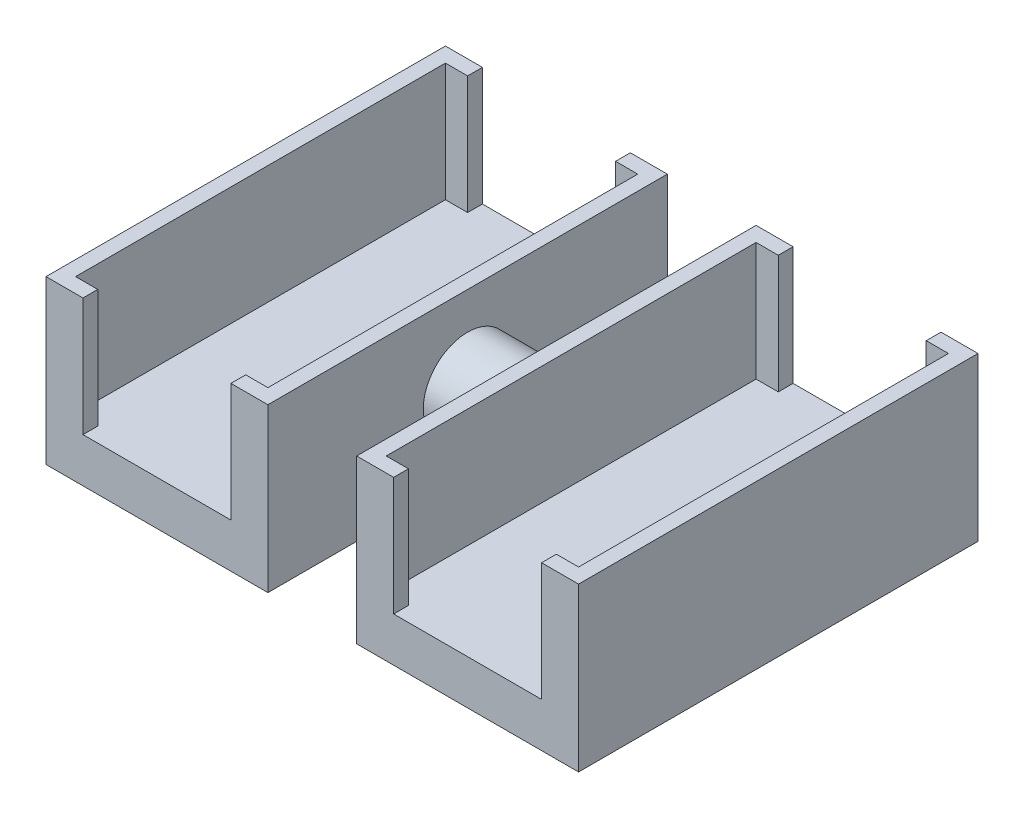
from build123d import *

# Parameters (mm, degrees)
BASE_REFERENCE_SKETCH_W = 15
BASE_REFERENCE_SKETCH_H = 27
BASE_EXTRUDE_DEPTH      = 3
BOSS_EXTRUDE2_START     = 3
BOSS_EXTRUDE2_DEPTH     = 8
BOSS_EXTRUDE4_START     = -3
SKETCH1_R               = 3
SKETCH1_R_2             = 1.5
BOSS_EXTRUDE4_DEPTH     = 6


with BuildPart() as part:
    # Base Reference Sketch → Base Extrude (new body)
    with BuildSketch(Plane(origin=(0, 0, 0), x_dir=(1, 0, 0), z_dir=(0, 1, 0))):
        with Locations((-10.5, 0)):
            Rectangle(BASE_REFERENCE_SKETCH_W, BASE_REFERENCE_SKETCH_H)
    extrude(amount=BASE_EXTRUDE_DEPTH)

    # Base Reference Sketch<5> → Boss-Extrude2 (add)
    with BuildSketch(Plane(origin=(0, 0, 0), x_dir=(1, 0, 0), z_dir=(0, 1, 0)).offset(BOSS_EXTRUDE2_START)):
        Polygon((-18, 13.5), (-15.5, 13.5), (-15.5, 12.5), (-17, 12.5), (-17, -12.5), (-15.5, -12.5), (-15.5, -13.5), (-18, -13.5), align=None)
        Polygon((-4, 12.5), (-4, -12.5), (-5.5, -12.5), (-5.5, -13.5), (-3, -13.5), (-3, 13.5), (-5.5, 13.5), (-5.5, 12.5), align=None)
    extrude(amount=BOSS_EXTRUDE2_DEPTH)


with BuildPart() as body_2:
    # Mirror2: mirrored copy
    add(part.part.mirror(Plane(origin=(0, 0, 0), x_dir=(0, 0, 1), z_dir=(1, 0, 0))))


with BuildPart() as part_1:
    add(part.part)

    add(body_2.part)  # Boss-Extrude4 merges body 2
    # Sketch1 → Boss-Extrude4 (add)
    with BuildSketch(Plane(origin=(0, 0, 0), x_dir=(0, 0, -1), z_dir=(1, 0, 0)).offset(BOSS_EXTRUDE4_START)):
        with Locations((0, 5.5)):
            Circle(SKETCH1_R)
        with Locations((0, 5.5)):
            Circle(SKETCH1_R_2, mode=Mode.SUBTRACT)
    extrude(amount=BOSS_EXTRUDE4_DEPTH)


solid = part_1.part
